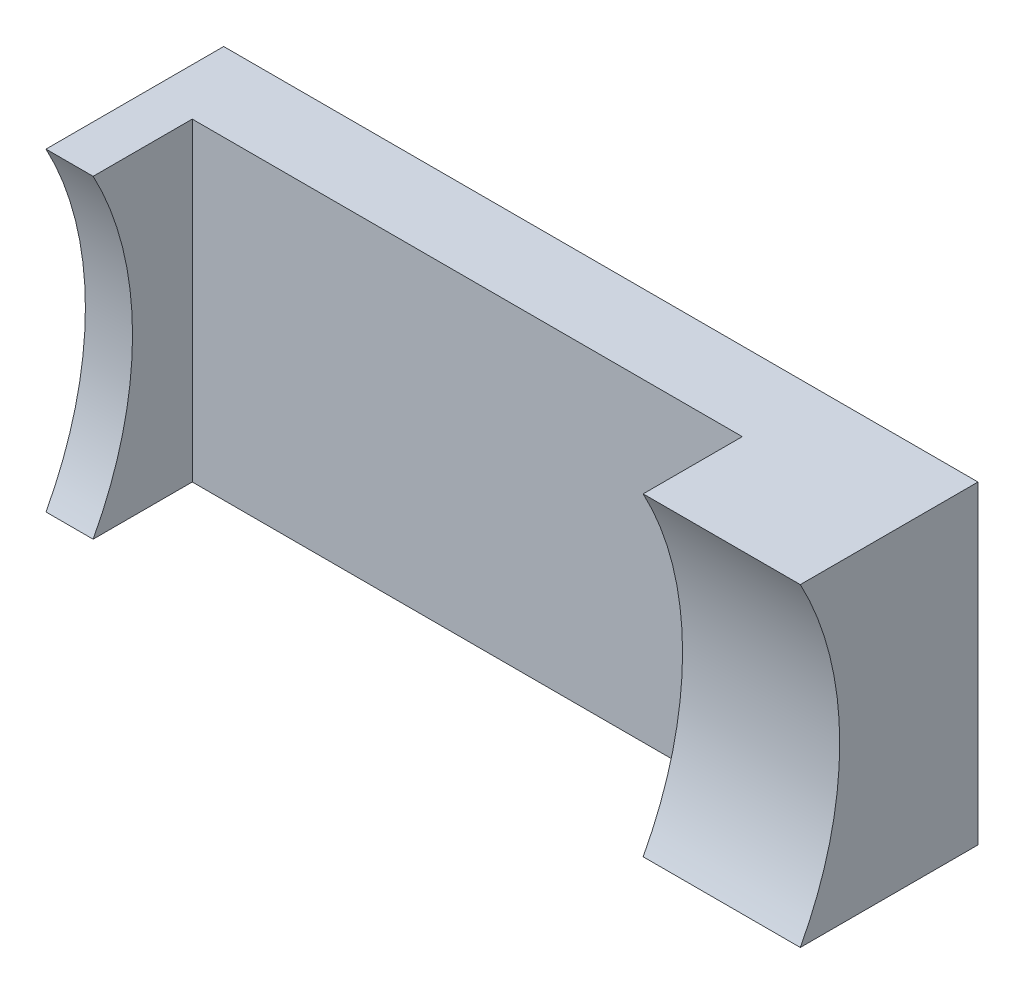
from build123d import *

# Parameters (mm, degrees)
SCHIZZO1_W                   = 48
SCHIZZO1_H                   = 20
ESTRUSIONE_ESTRUSIONE1_DEPTH = 5
SCHIZZO2_W                   = 3
SCHIZZO2_H                   = 20
SCHIZZO2_W_2                 = 10
ESTRUSIONE_ESTRUSIONE2_DEPTH = 25
TAGLIO_ESTRUSIONE1_REACH     = 59.48
SCHIZZO3_R                   = 21.2
SCHIZZO4_R                   = 2.5
ESTRUSIONE_ESTRUSIONE3_DEPTH = 5


with BuildPart() as part:
    # Schizzo1 → Estrusione-Estrusione1 (new body)
    with BuildSketch(Plane.XY):
        Rectangle(SCHIZZO1_W, SCHIZZO1_H)
    extrude(amount=ESTRUSIONE_ESTRUSIONE1_DEPTH)

    # Schizzo2 → Estrusione-Estrusione2 (add)
    with BuildSketch(Plane.XY.offset(5)):
        with Locations((-22.5, 0)):
            Rectangle(SCHIZZO2_W, SCHIZZO2_H)
        with Locations((19, 0)):
            Rectangle(SCHIZZO2_W_2, SCHIZZO2_H)
    extrude(amount=ESTRUSIONE_ESTRUSIONE2_DEPTH)

    # Taglio-Estrusione1: up to this face of the body (flat: up to its plane)
    taglio_estrusione1_end = Plane(part.part.faces().sort_by_distance((24, 0, 15))[0])
    # Schizzo3 → Taglio-Estrusione1 (cut, up to the picked face)
    with BuildSketch(Plane.ZY.offset(24), mode=Mode.PRIVATE) as taglio_estrusione1_sk1:
        with Locations((30, 0)):
            Circle(SCHIZZO3_R)
    taglio_estrusione1_tool1 = split(extrude(taglio_estrusione1_sk1.sketch, amount=-TAGLIO_ESTRUSIONE1_REACH, mode=Mode.PRIVATE), bisect_by=taglio_estrusione1_end, keep=Keep.BOTH, mode=Mode.PRIVATE)
    add(taglio_estrusione1_tool1.solids().sort_by(Axis((-24, 0, 30), (1, 0, 0)))[0], mode=Mode.SUBTRACT)

    # Schizzo4 → Estrusione-Estrusione3 (add)
    with BuildSketch(Plane(origin=(0, 0, 0), x_dir=(-1, 0, 0), z_dir=(0, 0, -1))):
        with Locations(Location((-9, 0, 0), (0, 0, 180))):
            Circle(SCHIZZO4_R)
        with Locations(Location((11, 0, 0), (0, 0, 180))):
            Circle(SCHIZZO4_R)
    extrude(amount=ESTRUSIONE_ESTRUSIONE3_DEPTH)


solid = part.part
